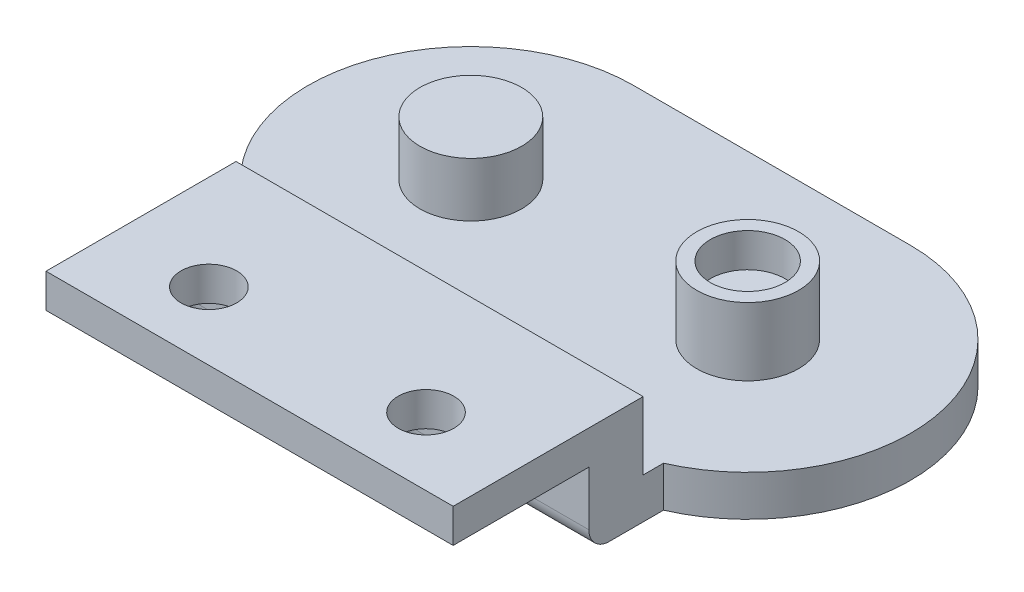
from build123d import *

# Parameters (mm, degrees)
BOSS_EXTRU_1_DEPTH      = 3
ESQUISSE2_R             = 3.75
BOSS_EXTRU_2_DEPTH      = 5
ESQUISSE4_W             = 30
ESQUISSE4_H             = 4
BOSS_EXTRU_3_DEPTH      = 5
ESQUISSE5_W             = 30
ESQUISSE5_H             = 2.5
BOSS_EXTRU_4_DEPTH      = 10
ESQUISSE6_R             = 2.05
ENL_V_MAT_EXTRU_3_DEPTH = 10
ESQUISSE7_R             = 2.75
ENL_V_MAT_EXTRU_4_DEPTH = 2.5
ESQUISSE8_R             = 3.75
BOSS_EXTRU_5_DEPTH      = 4
CONG_1_R                = 1.5


with BuildPart() as part:
    # Esquisse1 → Boss.-Extru.1 (new body)
    with BuildSketch(Plane(origin=(0, 0, 0), x_dir=(1, 0, 0), z_dir=(0, 1, 0))):
        with BuildLine():
            Line((-10.2, 12), (10.2, 12))
            ThreePointArc((10.2, 12), (21.946875755, 2.451715724), (15, -10.998181668))
            Line((15, -10.998181668), (15, -16.5))
            Line((15, -16.5), (-15, -16.5))
            Line((-15, -16.5), (-15, -10.998181668))
            ThreePointArc((-15, -10.998181668), (-21.946875755, 2.451715724), (-10.2, 12))
        make_face()
    extrude(amount=BOSS_EXTRU_1_DEPTH)

    # Esquisse2 → Boss.-Extru.2 (add)
    with BuildSketch(Plane(origin=(0, 3, 0), x_dir=(1, 0, 0), z_dir=(0, 1, 0))):
        with Locations(Location((10.2, 0, 0), (0, 0, 270))):
            Circle(ESQUISSE2_R)
    extrude(amount=BOSS_EXTRU_2_DEPTH)

    # Esquisse4 → Boss.-Extru.3 (add)
    with BuildSketch(Plane(origin=(0, 3, 0), x_dir=(1, 0, 0), z_dir=(0, 1, 0))):
        with Locations((0, -14.5)):
            Rectangle(ESQUISSE4_W, ESQUISSE4_H)
    extrude(amount=BOSS_EXTRU_3_DEPTH)

    # Esquisse5 → Boss.-Extru.4 (add)
    with BuildSketch(Plane.XY.offset(16.5)):
        with Locations((0, 6.75)):
            Rectangle(ESQUISSE5_W, ESQUISSE5_H)
    extrude(amount=BOSS_EXTRU_4_DEPTH)

    # Esquisse6 → Enlèv. mat.-Extru.3 (cut)
    with BuildSketch(Plane(origin=(0, 8, 0), x_dir=(1, 0, 0), z_dir=(0, 1, 0))):
        with Locations(Location((8, -21.5, 0), (0, 0, 270))):
            Circle(ESQUISSE6_R)
        with Locations(Location((-8, -21.5, 0), (0, 0, 270))):
            Circle(ESQUISSE6_R)
    extrude(amount=-ENL_V_MAT_EXTRU_3_DEPTH, mode=Mode.SUBTRACT)

    # Esquisse7 → Enlèv. mat.-Extru.4 (cut)
    with BuildSketch(Plane(origin=(0, 8, 0), x_dir=(1, 0, 0), z_dir=(0, 1, 0))):
        with Locations(Location((10.2, 0, 0), (0, 0, 270))):
            Circle(ESQUISSE7_R)
    extrude(amount=-ENL_V_MAT_EXTRU_4_DEPTH, mode=Mode.SUBTRACT)

    # Esquisse8 → Boss.-Extru.5 (add)
    with BuildSketch(Plane(origin=(0, 3, 0), x_dir=(1, 0, 0), z_dir=(0, 1, 0))):
        with Locations(Location((-10.2, 0, 0), (0, 0, 270))):
            Circle(ESQUISSE8_R)
    extrude(amount=BOSS_EXTRU_5_DEPTH)

    # Congé1
    cong_1_edges = [part.edges().sort_by_distance(p)[0] for p in [
        (0, 0, 16.5),
    ]]
    fillet(cong_1_edges, radius=CONG_1_R)


solid = part.part
